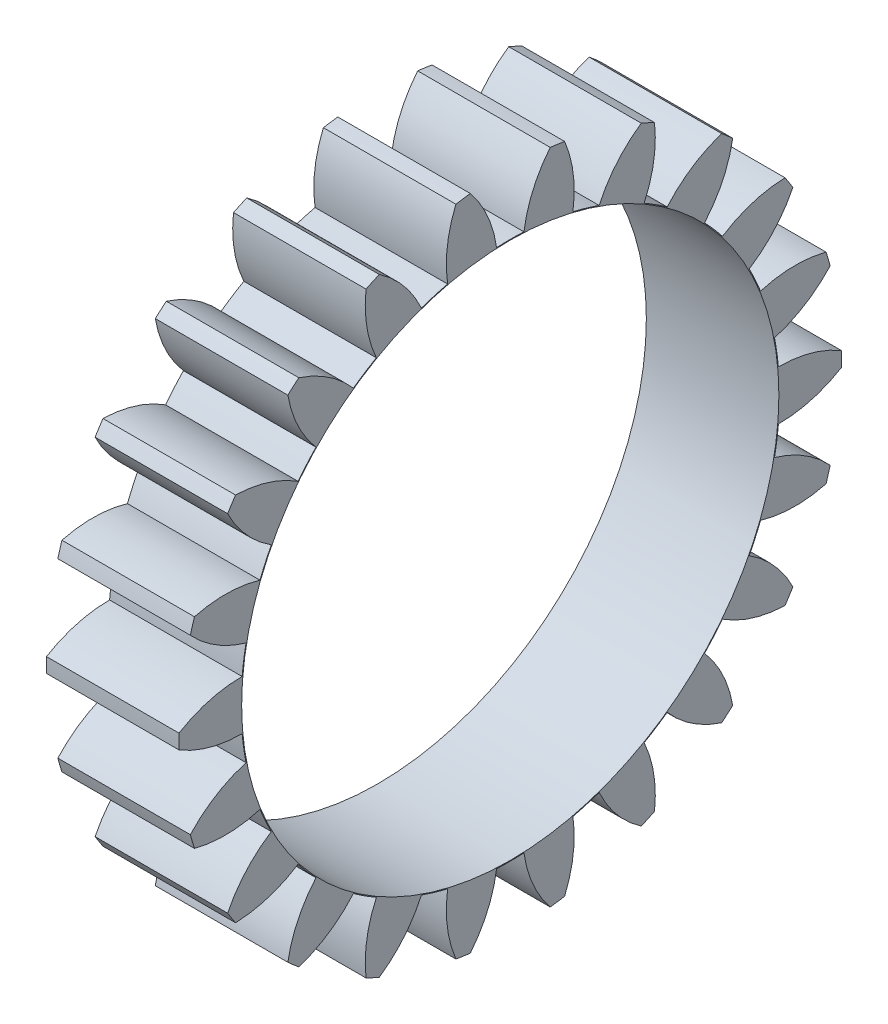
from build123d import *

# Parameters (mm, degrees)
BASPROSKE_W     = 5.08
BASPROSKE_H     = 12.7
TOOTHCUT_DEPTH  = 19.66511184
TEETHCUTS_COUNT = 22
TEETHCUTS_ANGLE = 343.636363636
BORSKE_R        = 10.295466667
BORE_DEPTH      = 50.8000508


with BuildPart() as part:
    # BasProSke → Base-Revolve (revolve)
    with BuildSketch(Plane(origin=(0, 0, 0), x_dir=(1, 0, 0), z_dir=(0, 1, 0)), mode=Mode.PRIVATE) as base_revolve_sk:
        with Locations((2.54, 6.35)):
            Rectangle(BASPROSKE_W, BASPROSKE_H)
    revolve(base_revolve_sk.sketch.rotate(Axis((-10, 0, 0), (1, 0, 0)), 180), axis=Axis((-10, 0, 0), (1, 0, 0)))

    # TooCutSke → ToothCut (cut, through all)
    with BuildSketch(Plane(origin=(0, 0, 0), x_dir=(0, 0, -1), z_dir=(1, 0, 0))):
        with BuildLine():
            ThreePointArc((0.523897651, 10.307561302), (0, 10.320866667), (-0.523897651, 10.307561302))
            ThreePointArc((-0.523897651, 10.307561302), (-0.875379555, 11.540402392), (-1.549709005, 12.630685142))
            ThreePointArc((-1.549709005, 12.630685142), (0, 12.7254), (1.549709005, 12.630685142))
            ThreePointArc((1.549709005, 12.630685142), (0.875379555, 11.540402392), (0.523897651, 10.307561302))
        make_face()
    toothcut = extrude(amount=TOOTHCUT_DEPTH, mode=Mode.SUBTRACT)

    # TeethCuts: ToothCut ×22 about axis
    teethcuts_axis = Axis((-10, 0, 0), (1, 0, 0))
    for i in range(1, TEETHCUTS_COUNT):
        add(toothcut.rotate(teethcuts_axis, i * TEETHCUTS_ANGLE / (TEETHCUTS_COUNT - 1)), mode=Mode.SUBTRACT)

    # BorSke → Bore (cut, symmetric)
    with BuildSketch(Plane(origin=(0, 0, 0), x_dir=(0, 0, -1), z_dir=(1, 0, 0))):
        with Locations(Location((0, 0, 0), (0, 0, 180))):
            Circle(BORSKE_R)
    extrude(amount=BORE_DEPTH, both=True, mode=Mode.SUBTRACT)


solid = part.part
